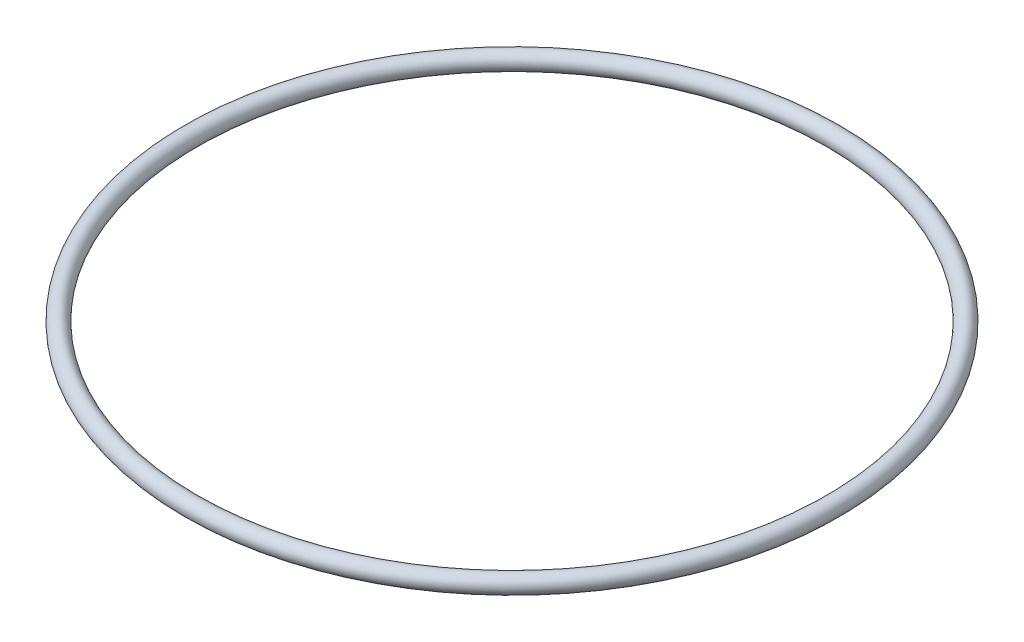
from build123d import *

# Parameters (mm, degrees)
SKETCH_1_R = 1.5


with BuildPart() as part:
    # Эскиз1 → Повернуть1 (revolve)
    with BuildSketch(Plane.XY, mode=Mode.PRIVATE) as revolve_1_sk:
        with Locations((54.70587299, 0)):
            Circle(SKETCH_1_R)
    revolve(revolve_1_sk.sketch.rotate(Axis((0, 8.136418944, 0), (0, -1, 0)), 90), axis=Axis((0, 8.136418944, 0), (0, -1, 0)))


solid = part.part
